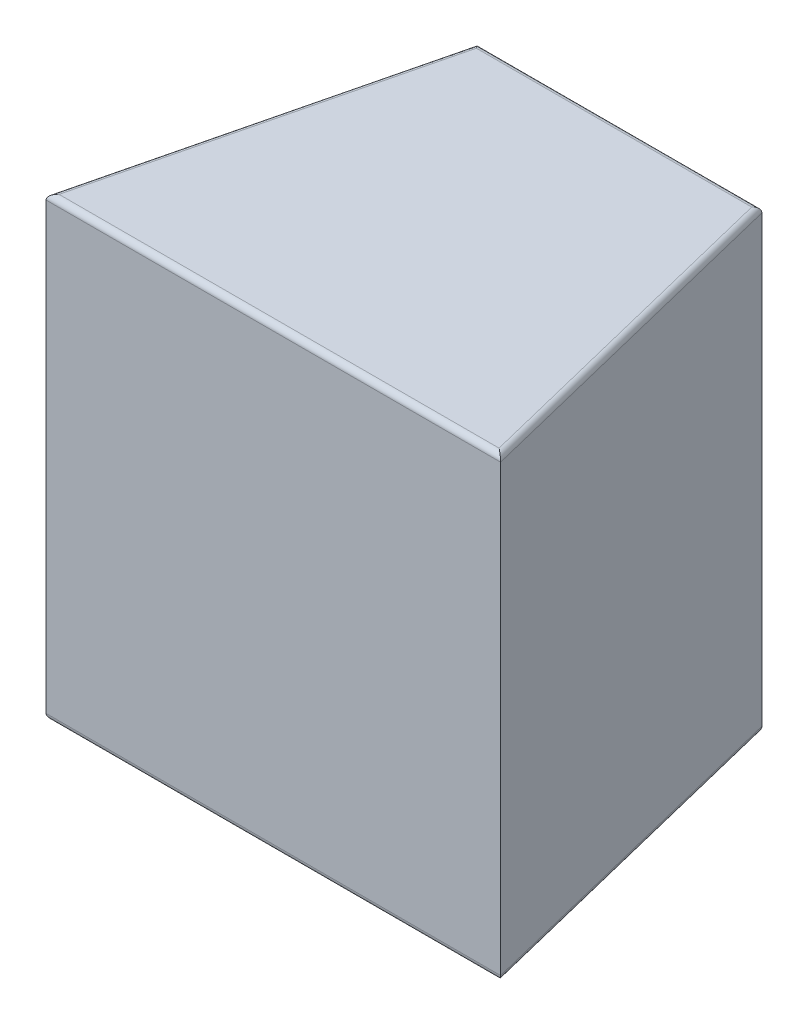
from build123d import *

# Parameters (mm, degrees)
BOSS_EXTRUDE1_DEPTH = 40
FILLET1_R           = 0.5


with BuildPart() as part:
    # Sketch1 → Boss-Extrude1 (new body)
    with BuildSketch(Plane(origin=(0, 0, 0), x_dir=(-1, 0, 0), z_dir=(0, 1, 0))):
        Polygon((-19.929898094, 15.28291465), (19.920028533, 15.304649416), (12.477351011, -15.099414457), (-12.454059318, -15.113012433), align=None)
    extrude(amount=BOSS_EXTRUDE1_DEPTH)

    # Fillet1
    fillet1_edges = [part.edges().sort_by_distance(p)[0] for p in [
        (-16.198689772, 40, 0.102617479),
        (0.00493478, 40, 15.293782033),
        (16.191978706, 40, 0.084951109),
        (0.00493478, 0, 15.293782033),
        (-16.198689772, 0, 0.102617479),
        (-0.011645847, 0, -15.106213445),
        (16.191978706, 0, 0.084951109),
        (-0.011645847, 40, -15.106213445),
    ]]
    fillet(fillet1_edges, radius=FILLET1_R)


solid = part.part
